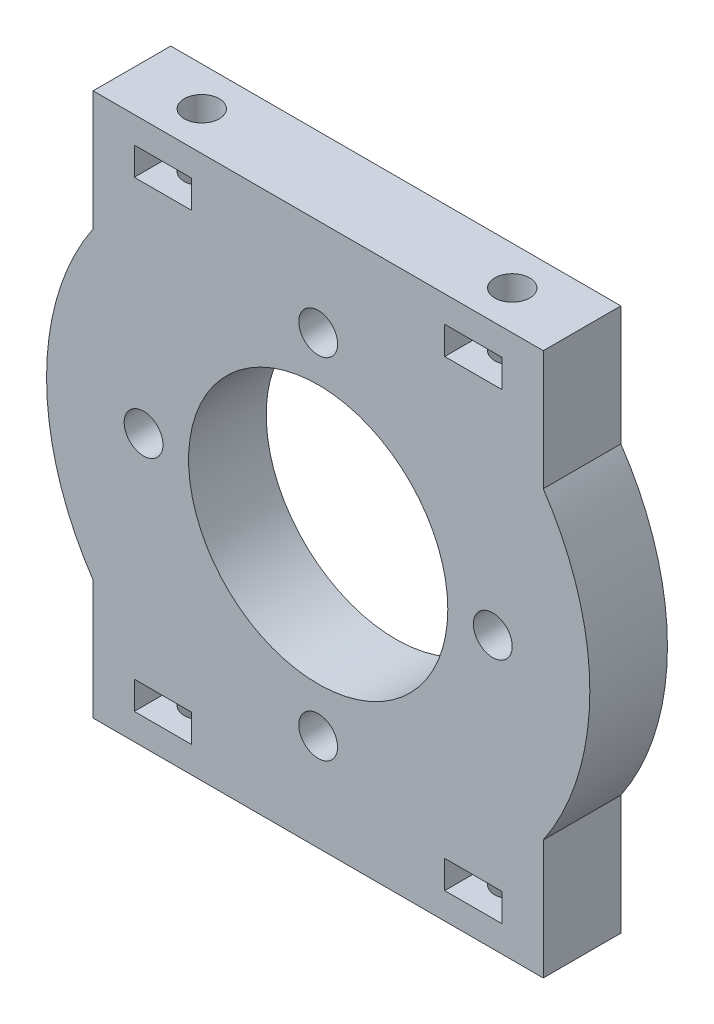
from build123d import *

# Parameters (mm, degrees)
CROQUIS1_R              = 16.7005
SALIENTE_EXTRUIR1_DEPTH = 5
CORTAR_EXTRUIR1_DEPTH   = 3.6
CROQUIS6_R              = 2.25
CORTAR_EXTRUIR2_DEPTH   = 10
CORTAR_EXTRUIR3_REACH   = 52.498
CROQUIS7_R              = 2.5


with BuildPart() as part:
    # Croquis1 → Saliente-Extruir1 (new, symmetric)
    with BuildSketch(Plane.XY):
        with BuildLine():
            Line((-29, 19.595917942), (-29, 35))
            Line((-29, 35), (29, 35))
            Line((29, 35), (29, 19.595917942))
            ThreePointArc((29, 19.595917942), (35, 0), (29, -19.595917942))
            Line((29, -19.595917942), (29, -35))
            Line((29, -35), (-29, -35))
            Line((-29, -35), (-29, -19.595917942))
            ThreePointArc((-29, -19.595917942), (-35, 0), (-29, 19.595917942))
        make_face()
        Circle(CROQUIS1_R, mode=Mode.SUBTRACT)
    extrude(amount=SALIENTE_EXTRUIR1_DEPTH, both=True)

    # Croquis5 → Cortar-Extruir1 (cut)
    with BuildSketch(Plane(origin=(0, 28, 0), x_dir=(1, 0, 0), z_dir=(0, 1, 0))):
        Polygon((-23.7, -2.136195996), (-23.7, -5), (-16.3, -5), (-16.3, -2.136195996), (-16.3, 2.136195996), (-20, 4.272391992), (-23.7, 2.136195996), align=None)
        Polygon((16.3, 2.136195996), (16.3, -2.136195996), (16.3, -5), (23.7, -5), (23.7, -2.136195996), (23.7, 2.136195996), (20, 4.272391992), align=None)
    cortar_extruir1 = extrude(amount=CORTAR_EXTRUIR1_DEPTH, mode=Mode.SUBTRACT)

    # Croquis6 → Cortar-Extruir2 (cut)
    with BuildSketch(Plane(origin=(0, 35, 0), x_dir=(1, 0, 0), z_dir=(0, 1, 0))):
        with Locations(Location((-20, 0, 0), (0, 0, 270))):
            Circle(CROQUIS6_R)
        with Locations(Location((20, 0, 0), (0, 0, 270))):
            Circle(CROQUIS6_R)
    cortar_extruir2 = extrude(amount=-CORTAR_EXTRUIR2_DEPTH, mode=Mode.SUBTRACT)

    # Simetría1: Cortar-Extruir1, Cortar-Extruir2 across plane
    add(cortar_extruir1.mirror(Plane.ZX), mode=Mode.SUBTRACT)
    add(cortar_extruir2.mirror(Plane.ZX), mode=Mode.SUBTRACT)

    # Croquis7 → Cortar-Extruir3 (cut, up to next)
    with BuildSketch(Plane.XY.offset(5), mode=Mode.PRIVATE) as cortar_extruir3_sk1:
        with Locations((0, 22.5)):
            Circle(CROQUIS7_R)
    cortar_extruir3_tool1 = extrude(cortar_extruir3_sk1.sketch, amount=-CORTAR_EXTRUIR3_REACH, mode=Mode.PRIVATE) & part.part
    # Croquis7 → Cortar-Extruir3 (cut, up to next)
    with BuildSketch(Plane.XY.offset(5), mode=Mode.PRIVATE) as cortar_extruir3_sk2:
        with Locations((22.5, 0)):
            Circle(CROQUIS7_R)
    cortar_extruir3_tool2 = extrude(cortar_extruir3_sk2.sketch, amount=-CORTAR_EXTRUIR3_REACH, mode=Mode.PRIVATE) & part.part
    # Croquis7 → Cortar-Extruir3 (cut, up to next)
    with BuildSketch(Plane.XY.offset(5), mode=Mode.PRIVATE) as cortar_extruir3_sk3:
        with Locations((0, -22.5)):
            Circle(CROQUIS7_R)
    cortar_extruir3_tool3 = extrude(cortar_extruir3_sk3.sketch, amount=-CORTAR_EXTRUIR3_REACH, mode=Mode.PRIVATE) & part.part
    # Croquis7 → Cortar-Extruir3 (cut, up to next)
    with BuildSketch(Plane.XY.offset(5), mode=Mode.PRIVATE) as cortar_extruir3_sk4:
        with Locations((-22.5, 0)):
            Circle(CROQUIS7_R)
    cortar_extruir3_tool4 = extrude(cortar_extruir3_sk4.sketch, amount=-CORTAR_EXTRUIR3_REACH, mode=Mode.PRIVATE) & part.part
    add(cortar_extruir3_tool1.solids().sort_by_distance((0, 22.5, 5))[0], mode=Mode.SUBTRACT)
    add(cortar_extruir3_tool2.solids().sort_by_distance((22.5, 0, 5))[0], mode=Mode.SUBTRACT)
    add(cortar_extruir3_tool3.solids().sort_by_distance((0, -22.5, 5))[0], mode=Mode.SUBTRACT)
    add(cortar_extruir3_tool4.solids().sort_by_distance((-22.5, 0, 5))[0], mode=Mode.SUBTRACT)


solid = part.part
